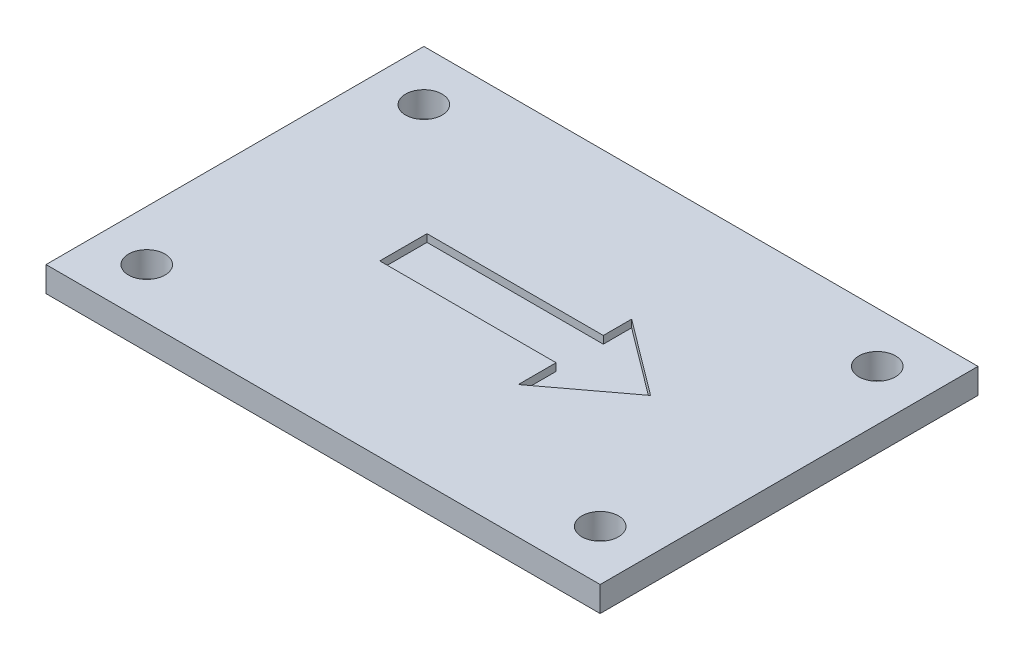
from build123d import *

# Parameters (mm, degrees)
SKETCH1_W                 = 44
SKETCH1_H                 = 30
LID_PLATE_DEPTH           = 2
SKETCH2_R                 = 1.45
CLEARANCE_HOLES_DEPTH     = 3
FORWARD_ARROW_X_DEPTH     = 0.6
SKETCH4_W                 = 12
SKETCH4_H                 = 2
BOARD_HOLD_DOWN_RIB_DEPTH = 2.4


with BuildPart() as part:
    # Sketch1 → Lid Plate (new body)
    with BuildSketch(Plane(origin=(0, 0, 0), x_dir=(1, 0, 0), z_dir=(0, 1, 0))):
        Rectangle(SKETCH1_W, SKETCH1_H)
    extrude(amount=LID_PLATE_DEPTH)

    # Sketch2 → Clearance Holes (cut)
    with BuildSketch(Plane(origin=(0, 2, 0), x_dir=(1, 0, 0), z_dir=(0, 1, 0))):
        with Locations(Location((-18, -11, 0), (0, 0, 270))):
            Circle(SKETCH2_R)
        with Locations(Location((-18, 11, 0), (0, 0, 270))):
            Circle(SKETCH2_R)
        with Locations(Location((18, -11, 0), (0, 0, 270))):
            Circle(SKETCH2_R)
        with Locations(Location((18, 11, 0), (0, 0, 270))):
            Circle(SKETCH2_R)
    extrude(amount=-CLEARANCE_HOLES_DEPTH, mode=Mode.SUBTRACT)

    # Sketch3 → Forward Arrow (+X) (cut)
    with BuildSketch(Plane(origin=(0, 2, 0), x_dir=(1, 0, 0), z_dir=(0, 1, 0))):
        Polygon((-9, -1.5), (5, -1.5), (5, -4.5), (11, 0), (5, 4.5), (5, 2.25), (-9, 2.25), align=None)
    extrude(amount=-FORWARD_ARROW_X_DEPTH, mode=Mode.SUBTRACT)

    # Sketch4 → Board Hold-Down Rib (add)
    with BuildSketch(Plane(origin=(0, 0, 0), x_dir=(1, 0, 0), z_dir=(0, 1, 0))):
        with Locations((0, -7)):
            Rectangle(SKETCH4_W, SKETCH4_H)
    extrude(amount=-BOARD_HOLD_DOWN_RIB_DEPTH)


solid = part.part
